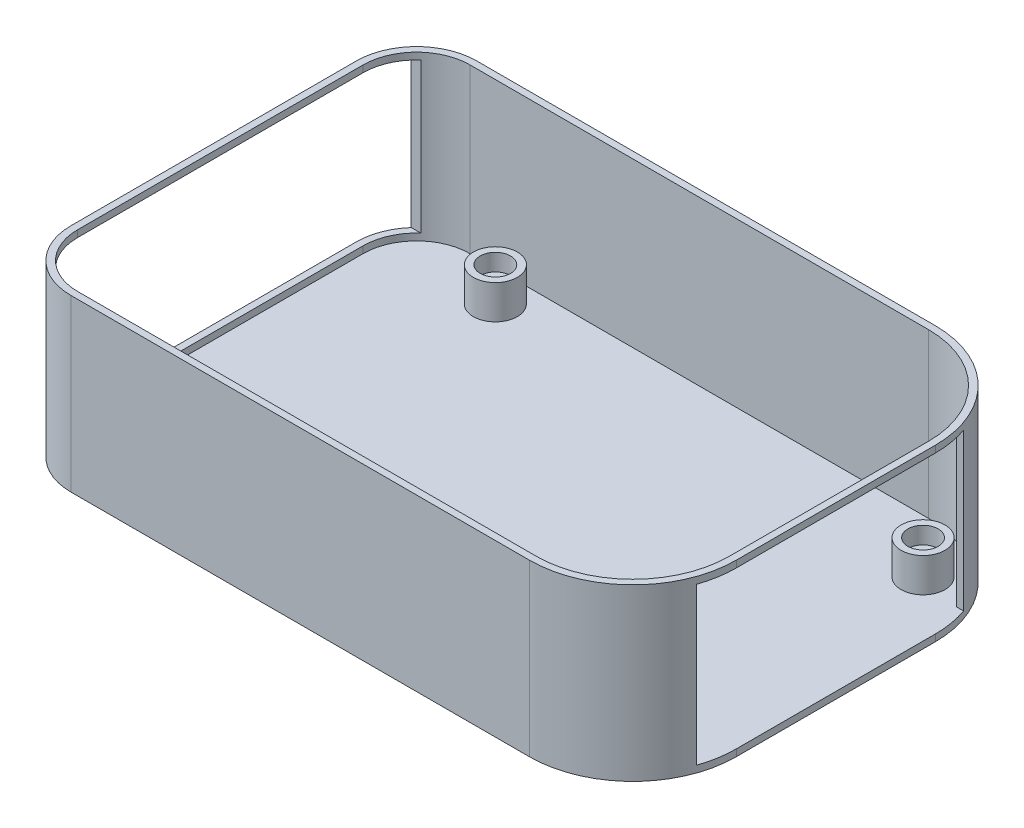
from build123d import *

# Parameters (mm, degrees)
BOSS_EXTRUDE1_DEPTH = 25
BOSS_EXTRUDE2_DEPTH = 1
SKETCH1_4_R         = 3.225
BOSS_EXTRUDE3_DEPTH = 6
SKETCH2_R           = 2.225
CUT_EXTRUDE1_DEPTH  = 2.5
SKETCH3_W           = 39.21
SKETCH3_H           = 23
CUT_EXTRUDE2_DEPTH  = 4
SKETCH4_W           = 53.61
SKETCH4_H           = 22
CUT_EXTRUDE3_DEPTH  = 7


with BuildPart() as part:
    # Sketch1 → Boss-Extrude1 (new body)
    with BuildSketch(Plane(origin=(0, 0, 0), x_dir=(1, 0, 0), z_dir=(0, 1, 0))):
        with BuildLine():
            Line((30.48, 29.805), (-36.83, 29.805))
            ThreePointArc((-36.83, 29.805), (-43.087895014, 27.212895014), (-45.68, 20.955))
            Line((-45.68, 20.955), (-45.68, -20.955))
            ThreePointArc((-45.68, -20.955), (-43.087895014, -27.212895014), (-36.83, -29.805))
            Line((-36.83, -29.805), (30.48, -29.805))
            ThreePointArc((30.48, -29.805), (41.228023074, -25.353023074), (45.68, -14.605))
            Line((45.68, -14.605), (45.68, 14.605))
            ThreePointArc((45.68, 14.605), (41.228023074, 25.353023074), (30.48, 29.805))
        make_face()
        with BuildLine():
            Line((-44.68, -20.955), (-44.68, 20.955))
            ThreePointArc((-44.68, 20.955), (-42.380788232, 26.505788232), (-36.83, 28.805))
            Line((-36.83, 28.805), (30.48, 28.805))
            ThreePointArc((30.48, 28.805), (40.520916293, 24.645916293), (44.68, 14.605))
            Line((44.68, 14.605), (44.68, -14.605))
            ThreePointArc((44.68, -14.605), (40.520916293, -24.645916293), (30.48, -28.805))
            Line((30.48, -28.805), (-36.83, -28.805))
            ThreePointArc((-36.83, -28.805), (-42.380788232, -26.505788232), (-44.68, -20.955))
        make_face(mode=Mode.SUBTRACT)
    extrude(amount=BOSS_EXTRUDE1_DEPTH)

    # Sketch1<3> → Boss-Extrude2 (add)
    with BuildSketch(Plane(origin=(0, 0, 0), x_dir=(1, 0, 0), z_dir=(0, 1, 0))):
        with BuildLine():
            ThreePointArc((-36.83, 28.805), (-42.380788232, 26.505788232), (-44.68, 20.955))
            Line((-44.68, 20.955), (-44.68, -20.955))
            ThreePointArc((-44.68, -20.955), (-42.380788232, -26.505788232), (-36.83, -28.805))
            Line((-36.83, -28.805), (30.48, -28.805))
            ThreePointArc((30.48, -28.805), (40.520916293, -24.645916293), (44.68, -14.605))
            Line((44.68, -14.605), (44.68, 14.605))
            ThreePointArc((44.68, 14.605), (40.520916293, 24.645916293), (30.48, 28.805))
            Line((30.48, 28.805), (-36.83, 28.805))
        make_face()
    extrude(amount=BOSS_EXTRUDE2_DEPTH)

    # Sketch1<4> → Boss-Extrude3 (add)
    with BuildSketch(Plane(origin=(0, 0, 0), x_dir=(1, 0, 0), z_dir=(0, 1, 0))):
        with Locations((-28.57, 24.265)):
            Circle(SKETCH1_4_R)
        with Locations((37.53, 20.955)):
            Circle(SKETCH1_4_R)
        with Locations((37.53, -20.955)):
            Circle(SKETCH1_4_R)
        with Locations((-28.57, -24.125)):
            Circle(SKETCH1_4_R)
    extrude(amount=BOSS_EXTRUDE3_DEPTH)

    # Sketch2 → Cut-Extrude1 (cut)
    with BuildSketch(Plane(origin=(0, 6, 0), x_dir=(1, 0, 0), z_dir=(0, 1, 0))):
        with Locations((-28.57, 24.265)):
            Circle(SKETCH2_R)
        with Locations((-28.57, -24.125)):
            Circle(SKETCH2_R)
        with Locations((37.53, -20.955)):
            Circle(SKETCH2_R)
        with Locations((37.53, 20.955)):
            Circle(SKETCH2_R)
    extrude(amount=-CUT_EXTRUDE1_DEPTH, mode=Mode.SUBTRACT)

    # Sketch3 → Cut-Extrude2 (cut)
    with BuildSketch(Plane(origin=(45.68, 0, 0), x_dir=(0, 0, -1), z_dir=(1, 0, 0))):
        with Locations((0, 12.5)):
            Rectangle(SKETCH3_W, SKETCH3_H)
    extrude(amount=-CUT_EXTRUDE2_DEPTH, mode=Mode.SUBTRACT)

    # Sketch4 → Cut-Extrude3 (cut)
    with BuildSketch(Plane.ZY.offset(45.68)):
        with Locations((0, 13)):
            Rectangle(SKETCH4_W, SKETCH4_H)
    extrude(amount=-CUT_EXTRUDE3_DEPTH, mode=Mode.SUBTRACT)


solid = part.part
